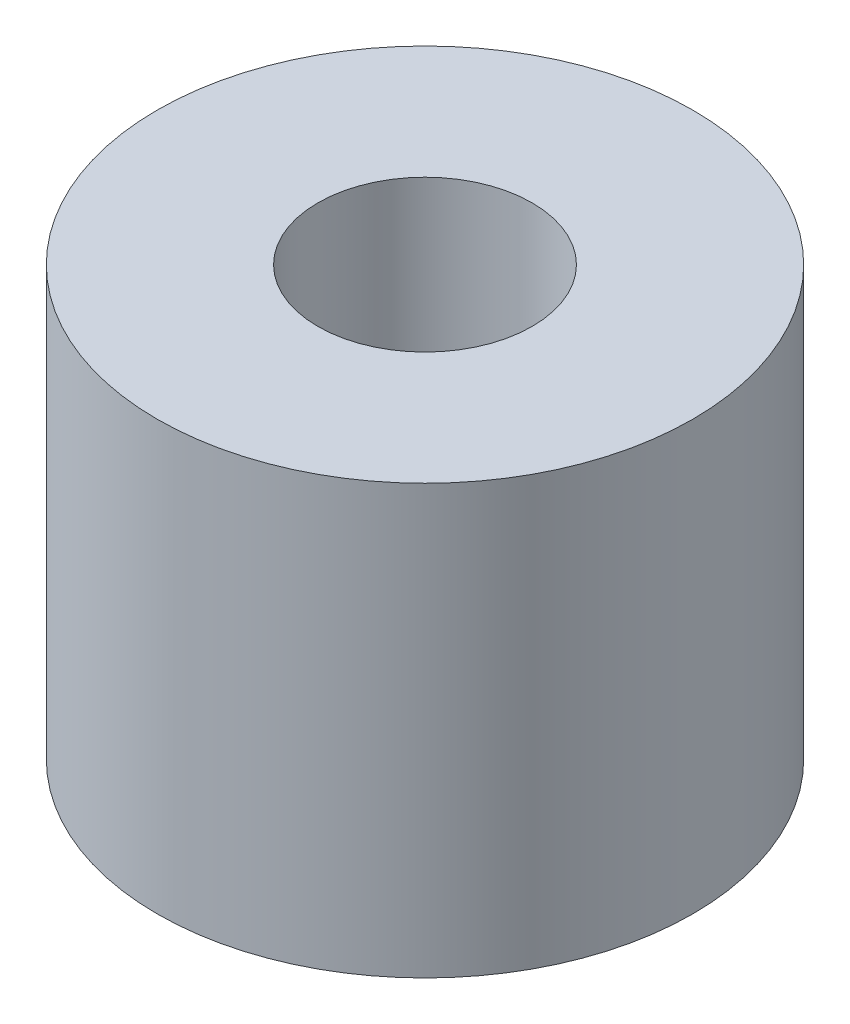
from build123d import *

# Parameters (mm, degrees)
SKETCH1_R           = 10
SKETCH1_R_2         = 4
BOSS_EXTRUDE1_DEPTH = 16


with BuildPart() as part:
    # Sketch1 → Boss-Extrude1 (new body)
    with BuildSketch(Plane(origin=(0, 0, 0), x_dir=(1, 0, 0), z_dir=(0, 1, 0))):
        with Locations(Location((0, 0, 0), (0, 0, 270))):
            Circle(SKETCH1_R)
        with Locations(Location((0, 0, 0), (0, 0, 270))):
            Circle(SKETCH1_R_2, mode=Mode.SUBTRACT)
    extrude(amount=BOSS_EXTRUDE1_DEPTH)


solid = part.part
